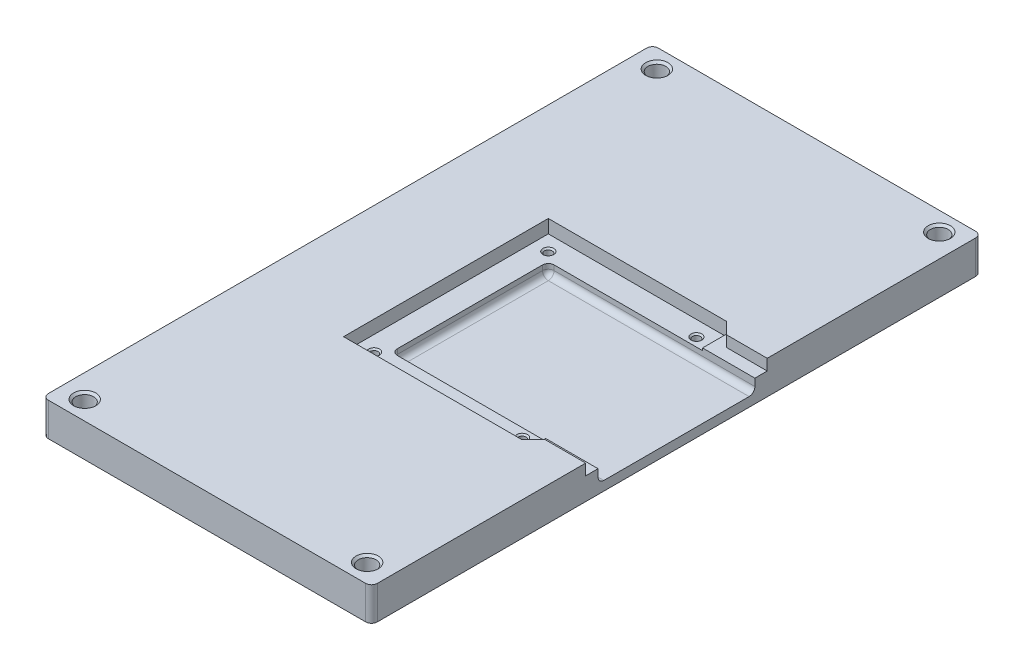
from build123d import *

# Parameters (mm, degrees)
BOSS_EXTRUDE1_DEPTH     = 11.5
SKETCH4_R               = 3.075
CUT_EXTRUDE1_DEPTH      = 6
CUT_EXTRUDE6_DEPTH      = 4.6
CUT_EXTRUDE3_DEPTH      = 120.494772375
CUT_EXTRUDE3_DEPTH_BACK = 3.7
SKETCH24_W              = 71.125
SKETCH24_H              = 54
SKETCH25_R              = 1.35
CUT_EXTRUDE4_DEPTH      = 5
CHAMFER4_SIZE           = 0.5
FILLET1_R               = 2
BOSS_EXTRUDE2_DEPTH     = 0.8
CHAMFER5_SIZE           = 0.75


with BuildPart() as part:
    # Sketch1 → Boss-Extrude1 (new body)
    with BuildSketch(Plane(origin=(0, 0, 0), x_dir=(1, 0, 0), z_dir=(0, 1, 0))):
        with BuildLine():
            Line((-56.625, 90), (-56.625, -90))
            Line((-56.625, -90), (-56.625, -103))
            ThreePointArc((-56.625, -103), (-56.039213562, -104.414213562), (-54.625, -105))
            Line((-54.625, -105), (54.625, -105))
            ThreePointArc((54.625, -105), (56.039213562, -104.414213562), (56.625, -103))
            Line((56.625, -103), (56.625, -90))
            Line((56.625, -90), (56.625, 90))
            Line((56.625, 90), (56.625, 103))
            ThreePointArc((56.625, 103), (56.039213562, 104.414213562), (54.625, 105))
            Line((54.625, 105), (-54.625, 105))
            ThreePointArc((-54.625, 105), (-56.039213562, 104.414213562), (-56.625, 103))
            Line((-56.625, 103), (-56.625, 90))
        make_face()
    extrude(amount=BOSS_EXTRUDE1_DEPTH)

    # Sketch4 → Cut-Extrude1 (cut)
    with BuildSketch(Plane(origin=(0, 11.5, 0), x_dir=(1, 0, 0), z_dir=(0, 1, 0))):
        with Locations(Location((-48.625, -98.5, 0), (0, 0, 270))):
            Circle(SKETCH4_R)
        with Locations(Location((48.625, -98.5, 0), (0, 0, 270))):
            Circle(SKETCH4_R)
        with Locations(Location((48.625, 98.5, 0), (0, 0, 270))):
            Circle(SKETCH4_R)
        with Locations(Location((-48.625, 98.5, 0), (0, 0, 270))):
            Circle(SKETCH4_R)
    extrude(amount=-CUT_EXTRUDE1_DEPTH, mode=Mode.SUBTRACT)

    # Sketch21 → Cut-Extrude6 (cut)
    with BuildSketch(Plane(origin=(0, 11.5, 0), x_dir=(1, 0, 0), z_dir=(0, 1, 0))):
        Polygon((56.625, 31), (56.625, -31), (56.625, -31.25), (42.603553391, -31.25), (38.603553391, -35.25), (-22.75, -35.25), (-22.75, 35.25), (38.603553391, 35.25), (42.603553391, 31.25), (56.625, 31.25), align=None)
    extrude(amount=-CUT_EXTRUDE6_DEPTH, mode=Mode.SUBTRACT)

    # Sketch24 → Cut-Extrude3 (cut, two sides: drawn at the far end of the back side and taken through both)
    with BuildSketch(Plane(origin=(0, 6.9, 0), x_dir=(1, 0, 0), z_dir=(0, 1, 0)).offset(-CUT_EXTRUDE3_DEPTH_BACK)):
        with Locations((21.0625, 0)):
            Rectangle(SKETCH24_W, SKETCH24_H)
    extrude(amount=CUT_EXTRUDE3_DEPTH + CUT_EXTRUDE3_DEPTH_BACK, mode=Mode.SUBTRACT)

    # Sketch25 → Cut-Extrude4 (cut)
    with BuildSketch(Plane(origin=(0, 6.9, 0), x_dir=(1, 0, 0), z_dir=(0, 1, 0))):
        with Locations(Location((33.5, 30, 0), (0, 0, 270))):
            Circle(SKETCH25_R)
        with Locations(Location((-17.5, 30, 0), (0, 0, 270))):
            Circle(SKETCH25_R)
        with Locations(Location((33.5, -30, 0), (0, 0, 270))):
            Circle(SKETCH25_R)
        with Locations(Location((-17.5, -30, 0), (0, 0, 270))):
            Circle(SKETCH25_R)
    extrude(amount=-CUT_EXTRUDE4_DEPTH, mode=Mode.SUBTRACT)

    # Chamfer4
    chamfer4_edges = [part.edges().sort_by_distance(p)[0] for p in [
        (-17.5, 6.9, -31.35),
        (33.5, 6.9, 28.65),
        (-17.5, 6.9, 28.65),
        (33.5, 6.9, -31.35),
    ]]
    chamfer(chamfer4_edges, length=CHAMFER4_SIZE)

    # Fillet1
    fillet1_edges = [part.edges().sort_by_distance(p)[0] for p in [
        (21.0625, 3.2, -27),
        (-14.5, 5.05, -27),
        (-14.5, 3.2, 0),
        (-14.5, 5.05, 27),
        (21.0625, 3.2, 27),
    ]]
    fillet(fillet1_edges, radius=FILLET1_R)

    # Sketch26 → Boss-Extrude2 (add)
    with BuildSketch(Plane(origin=(0, 6.9, 0), x_dir=(1, 0, 0), z_dir=(0, 1, 0))):
        Polygon((38.603553391, 35.25), (38.603553391, 27), (56.625, 27), (56.625, 31.25), (42.603553391, 31.25), align=None)
        Polygon((42.603553391, -31.25), (38.603553391, -35.25), (38.603553391, -27), (56.625, -27), (56.625, -31.25), align=None)
    extrude(amount=BOSS_EXTRUDE2_DEPTH)

    # Chamfer5
    chamfer5_edges = [part.edges().sort_by_distance(p)[0] for p in [
        (-48.625, 11.5, -101.575),
        (48.625, 11.5, -101.575),
        (48.625, 11.5, 95.425),
        (-48.625, 11.5, 95.425),
    ]]
    chamfer(chamfer5_edges, length=CHAMFER5_SIZE)


solid = part.part
